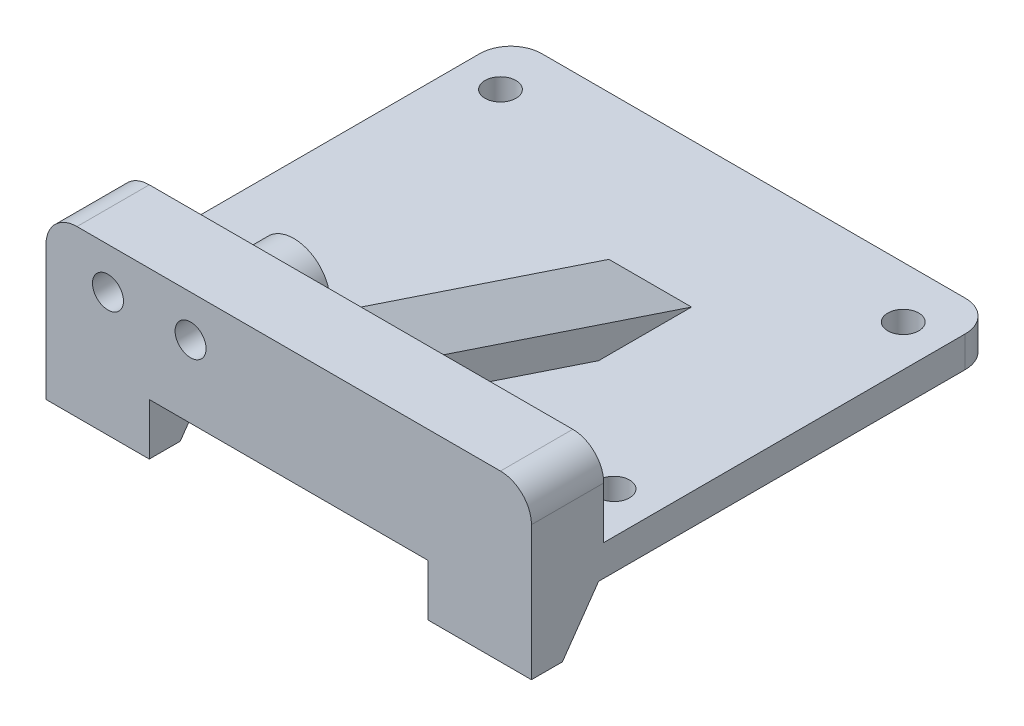
from build123d import *
from build123d.topology import SkipClean

# Parameters (mm, degrees)
SKETCH_1_W      = 47
SKETCH_1_H      = 38
SKETCH_1_R      = 1.5
EXTRUDE_1_DEPTH = 3
SKETCH_2_W      = 47
SKETCH_2_H      = 11
SKETCH_2_R      = 1.5
EXTRUDE_2_DEPTH = 7
EXTRUDE_3_DEPTH = 8
FILLET_4_R      = 3
EXTRUDE_4_DEPTH = 10
FILLET_6_R      = 3
EXTRUDE_START   = 3
SKETCH_7_R      = 3.5
SKETCH_7_R_2    = 1.5
EXTRUDE_5_DEPTH = 3


with BuildPart() as part:
    # 草图1 → 凸台-拉伸1 (new body)
    with BuildSketch(Plane(origin=(0, 0, 0), x_dir=(1, 0, 0), z_dir=(0, 1, 0))):
        Rectangle(SKETCH_1_W, SKETCH_1_H)
        with Locations(Location((19.5, 14, 0), (0, 0, 270))):
            Circle(SKETCH_1_R, mode=Mode.SUBTRACT)
        with Locations(Location((19.5, -14, 0), (0, 0, 270))):
            Circle(SKETCH_1_R, mode=Mode.SUBTRACT)
        with Locations(Location((-19.5, -14, 0), (0, 0, 270))):
            Circle(SKETCH_1_R, mode=Mode.SUBTRACT)
        with Locations(Location((-19.5, 14, 0), (0, 0, 270))):
            Circle(SKETCH_1_R, mode=Mode.SUBTRACT)
    extrude(amount=EXTRUDE_1_DEPTH)

    # 草图2 → 凸台-拉伸2 (add)
    with BuildSketch(Plane.XY.offset(19)):
        with Locations((0, 5.5)):
            Rectangle(SKETCH_2_W, SKETCH_2_H)
        with Locations((-17.5, 7)):
            Circle(SKETCH_2_R, mode=Mode.SUBTRACT)
        with Locations((-9.5, 7)):
            Circle(SKETCH_2_R, mode=Mode.SUBTRACT)
    extrude(amount=EXTRUDE_2_DEPTH)

    # 草图3 → 凸台-拉伸3 (add)
    with BuildSketch(Plane(origin=(0, 0, 0), x_dir=(0, 0, -1), z_dir=(1, 0, 0))):
        Polygon((-19, 11), (-19, 8), (-4, 3), (5, 3), align=None)
    extrude(amount=EXTRUDE_3_DEPTH)

    # 圆角4
    fillet_4_edges = [part.edges().sort_by_distance(p)[0] for p in [
        (-23.5, 11, 22.5),
        (23.5, 11, 22.5),
    ]]
    fillet(fillet_4_edges, radius=FILLET_4_R)

    # 草图4 → 凸台-拉伸4 (add)
    with BuildSketch(Plane.ZY.offset(23.5)):
        Polygon((26, 0), (26, -5), (23, -5), (19.5, 0), align=None)
    extrude_4 = extrude(amount=-EXTRUDE_4_DEPTH)

    # 镜向1: 凸台-拉伸4 across plane
    add(extrude_4.mirror(Plane(origin=(0, 0, 0), x_dir=(0, 0, 1), z_dir=(1, 0, 0))))

    # 圆角6
    fillet_6_edges = [part.edges().sort_by_distance(p)[0] for p in [
        (-23.5, 1.5, -19),
        (23.5, 1.5, -19),
    ]]
    fillet(fillet_6_edges, radius=FILLET_6_R)

    # 草图7 → 凸台-拉伸5 (add)
    with SkipClean():  # the faces are left unmerged after this step: merging them gives an invalid solid
        with BuildSketch(Plane(origin=(0, 0, 19), x_dir=(-1, 0, 0), z_dir=(0, 0, -1)).offset(EXTRUDE_START)):
            with Locations(Location((9.5, 7, 0), (0, 0, 180))):
                Circle(SKETCH_7_R)
            with Locations((9.5, 7)):
                Circle(SKETCH_7_R_2, mode=Mode.SUBTRACT)
        extrude(amount=-EXTRUDE_5_DEPTH)


solid = part.part
